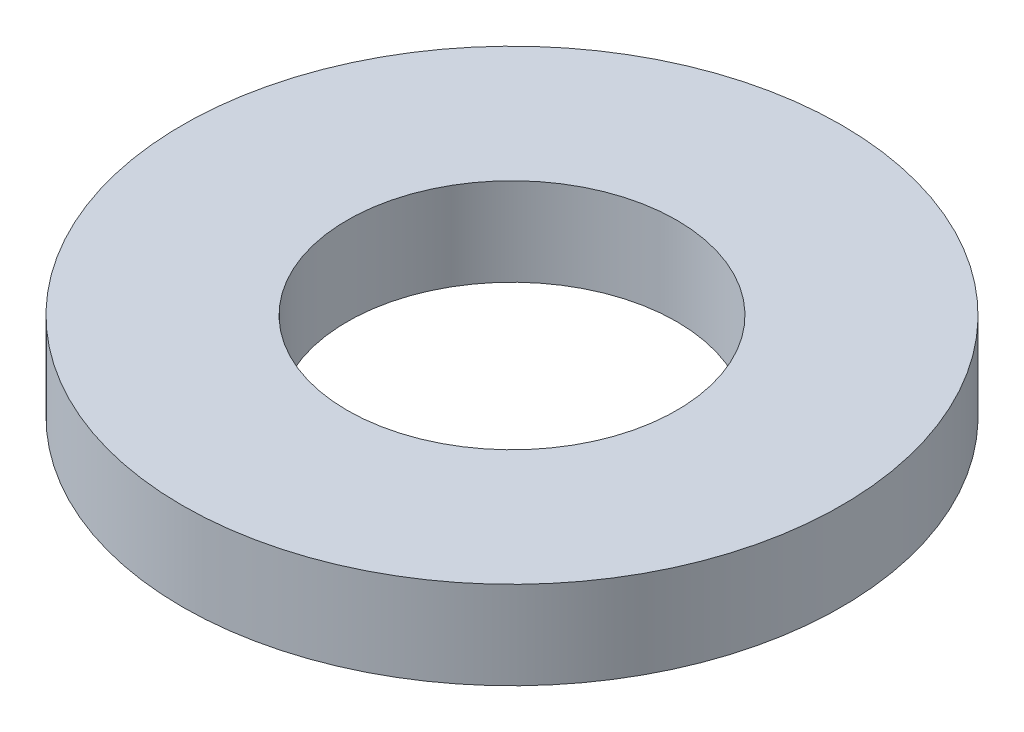
from build123d import *

# Parameters (mm, degrees)
SKETCH_1_R      = 3
SKETCH_1_R_2    = 1.5
EXTRUDE_1_DEPTH = 0.4


with BuildPart() as part:
    # 草图1 → 凸台-拉伸1 (new, symmetric)
    with BuildSketch(Plane(origin=(0, 0, 0), x_dir=(1, 0, 0), z_dir=(0, 1, 0))):
        with Locations(Location((0, 0, 0), (0, 0, 270))):
            Circle(SKETCH_1_R)
        with Locations(Location((0, 0, 0), (0, 0, 270))):
            Circle(SKETCH_1_R_2, mode=Mode.SUBTRACT)
    extrude(amount=EXTRUDE_1_DEPTH, both=True)


solid = part.part
